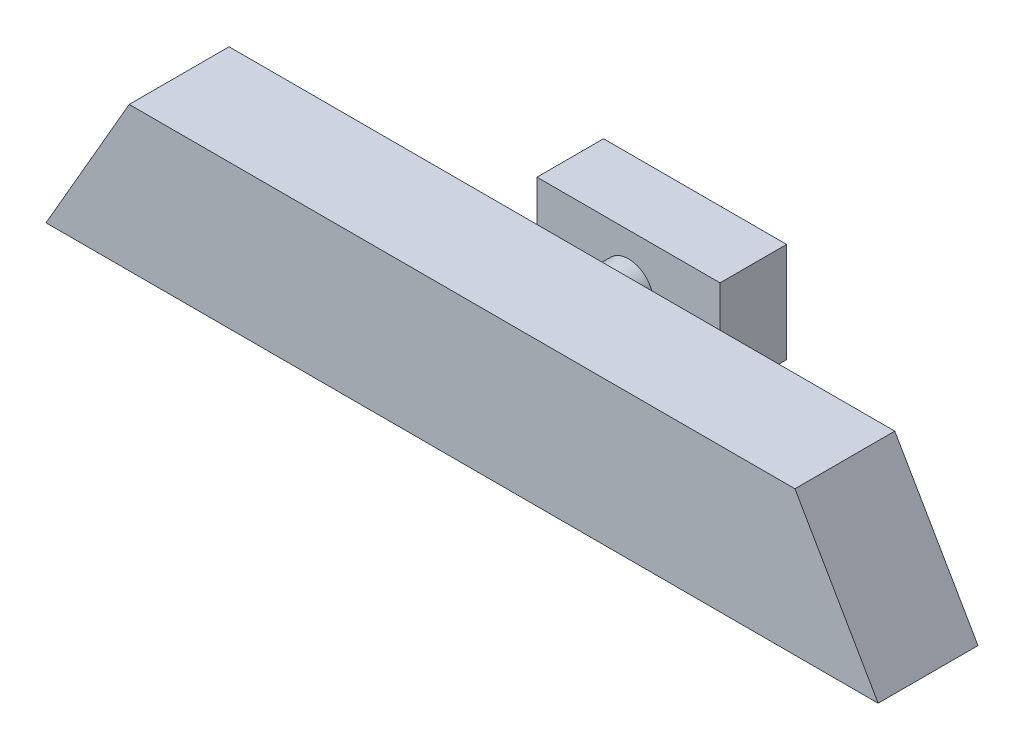
from build123d import *

# Parameters (mm, degrees)
EXTRUDE_1_DEPTH     = 30
SKETCH_2_R          = 7.5
EXTRUDE_2_DEPTH     = 20
SKETCH_3_W          = 55
SKETCH_3_H          = 30
EXTRUDE_3_DEPTH     = 20
SKETCH_4_R          = 5
CUT_EXTRUDE_1_DEPTH = 10


with BuildPart() as part:
    # 草图1 → 凸台-拉伸1 (new body)
    with BuildSketch(Plane.XY):
        Polygon((-52.460777496, 0), (197.539222504, 0), (172.539222504, 43.301270189), (-27.460777496, 43.301270189), align=None)
    extrude(amount=EXTRUDE_1_DEPTH)

    # 草图2 → 凸台-拉伸2 (add)
    with BuildSketch(Plane(origin=(0, 0, 0), x_dir=(-1, 0, 0), z_dir=(0, 0, -1))):
        with Locations(Location((-72.539222504, 20.626682139, 0), (0, 0, 180))):
            Circle(SKETCH_2_R)
    extrude(amount=EXTRUDE_2_DEPTH)

    # 草图3 → 凸台-拉伸3 (add)
    with BuildSketch(Plane(origin=(0, 0, -20), x_dir=(-1, 0, 0), z_dir=(0, 0, -1))):
        with Locations((-72.539222504, 20.626682139)):
            Rectangle(SKETCH_3_W, SKETCH_3_H)
    extrude(amount=EXTRUDE_3_DEPTH)

    # 草图4 → 切除-拉伸1 (cut)
    with BuildSketch(Plane(origin=(0, 0, -40), x_dir=(-1, 0, 0), z_dir=(0, 0, -1))):
        with Locations((-72.539222504, 20.626682139)):
            Circle(SKETCH_4_R)
    extrude(amount=-CUT_EXTRUDE_1_DEPTH, mode=Mode.SUBTRACT)


solid = part.part
